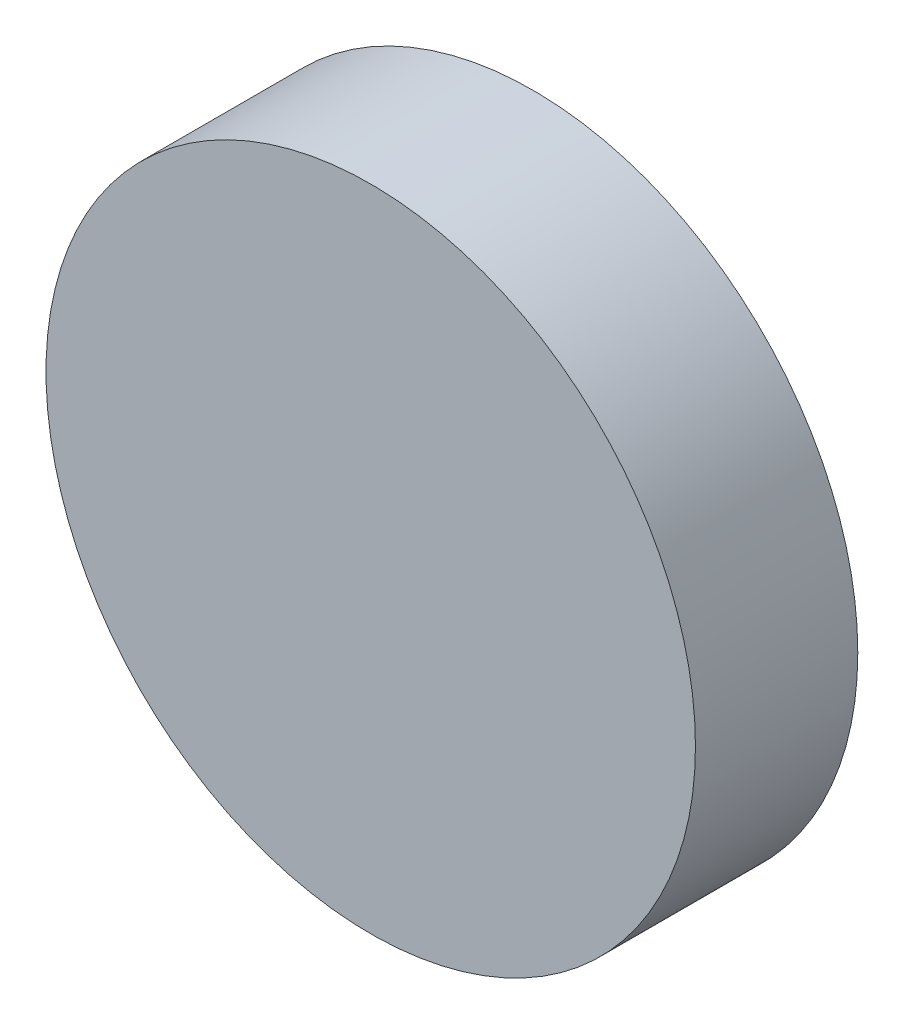
from build123d import *

# Parameters (mm, degrees)
SKETCH1_R           = 6.35
BOSS_EXTRUDE1_DEPTH = 2.54
SKETCH1_2_R         = 6.35
BOSS_EXTRUDE2_DEPTH = 3.175


with BuildPart() as part:
    # Sketch1 → Boss-Extrude1 (new body)
    with BuildSketch(Plane.XY):
        Circle(SKETCH1_R)
    extrude(amount=BOSS_EXTRUDE1_DEPTH)

    # Sketch1<2> → Boss-Extrude2 (add)
    with BuildSketch(Plane.XY):
        Circle(SKETCH1_2_R)
    extrude(amount=BOSS_EXTRUDE2_DEPTH)


solid = part.part
